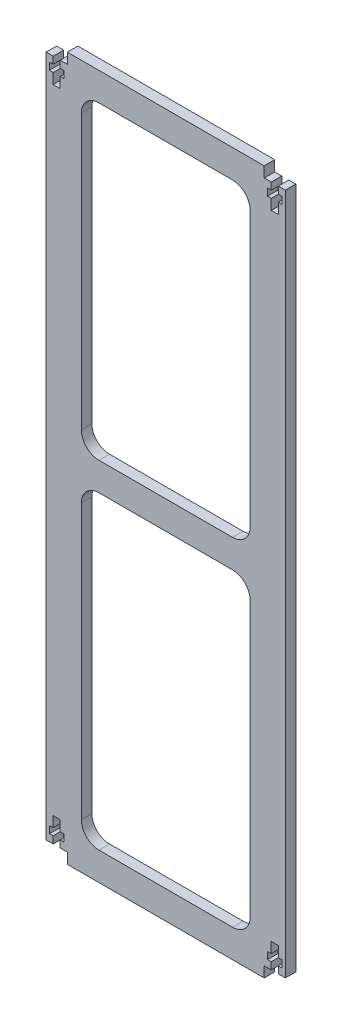
from build123d import *

# Parameters (mm, degrees)
SKETCH_1_W             = 68
SKETCH_1_H             = 200
EXTRUDE_1_DEPTH        = 3
SKETCH_2_W             = 6
SKETCH_2_H             = 3
CUT_EXTRUDE_1_DEPTH    = 212.265236137
SKETCH_3_W             = 48
SKETCH_3_H             = 88
CUT_EXTRUDE_2_DEPTH    = 212.265236137
FILLET_1_R             = 5
CUT_EXTRUDE_3_DEPTH    = 212.265236137
PATTERN_LINEAR_1_COUNT = 2
PATTERN_LINEAR_1_PITCH = 62
MIRROR_1_COPY_1_DEPTH  = 212.265236137


with BuildPart() as part:
    # 草图1 → 凸台-拉伸1 (new body)
    with BuildSketch(Plane.XY):
        with Locations((34, 100)):
            Rectangle(SKETCH_1_W, SKETCH_1_H)
    extrude(amount=EXTRUDE_1_DEPTH)

    # 草图2 → 切除-拉伸1 (cut, through all)
    with BuildSketch(Plane.XY.offset(3)):
        with Locations((65, 198.5)):
            Rectangle(SKETCH_2_W, SKETCH_2_H)
        with Locations((3, 198.5)):
            Rectangle(SKETCH_2_W, SKETCH_2_H)
        with Locations((65, 1.5)):
            Rectangle(SKETCH_2_W, SKETCH_2_H)
        with Locations((3, 1.5)):
            Rectangle(SKETCH_2_W, SKETCH_2_H)
    extrude(amount=-CUT_EXTRUDE_1_DEPTH, mode=Mode.SUBTRACT)

    # 草图3 → 切除-拉伸2 (cut, through all)
    with BuildSketch(Plane.XY.offset(3)):
        with Locations((34, 148)):
            Rectangle(SKETCH_3_W, SKETCH_3_H)
        with Locations((34, 52)):
            Rectangle(SKETCH_3_W, SKETCH_3_H)
    extrude(amount=-CUT_EXTRUDE_2_DEPTH, mode=Mode.SUBTRACT)

    # 圆角1
    fillet_1_edges = [part.edges().sort_by_distance(p)[0] for p in [
        (58, 192, 1.5),
        (58, 104, 1.5),
        (10, 104, 1.5),
        (10, 192, 1.5),
        (58, 96, 1.5),
        (58, 8, 1.5),
        (10, 8, 1.5),
        (10, 96, 1.5),
    ]]
    fillet(fillet_1_edges, radius=FILLET_1_R)

    # 草图4 → 切除-拉伸3 (cut, through all)
    with BuildSketch(Plane.XY.offset(3)):
        Polygon((2, 3), (4, 3), (4, 5), (5.05, 5), (5.05, 7), (4, 7), (4, 10), (2, 10), (2, 7), (0.95, 7), (0.95, 5), (2, 5), align=None)
    cut_extrude_3 = extrude(amount=-CUT_EXTRUDE_3_DEPTH, mode=Mode.SUBTRACT)

    # 阵列(线性)1: 切除-拉伸3 ×2
    with Locations(*[(i * PATTERN_LINEAR_1_PITCH, 0, 0) for i in range(1, PATTERN_LINEAR_1_COUNT)]):
        add(cut_extrude_3, mode=Mode.SUBTRACT)

    # 镜向1: 切除-拉伸3 across plane
    add(cut_extrude_3.mirror(Plane(origin=(0, 100, 0), x_dir=(0, 0, 1), z_dir=(0, -1, 0))), mode=Mode.SUBTRACT)

    # 镜向1 copy 1 sketch → 镜向1 copy 1 (cut, through all)
    with BuildSketch(Plane(origin=(62, 200, 3), x_dir=(1, 0, 0), z_dir=(0, 0, 1))):
        Polygon((2, -3), (4, -3), (4, -5), (5.05, -5), (5.05, -7), (4, -7), (4, -10), (2, -10), (2, -7), (0.95, -7), (0.95, -5), (2, -5), align=None)
    extrude(amount=-MIRROR_1_COPY_1_DEPTH, mode=Mode.SUBTRACT)


solid = part.part
